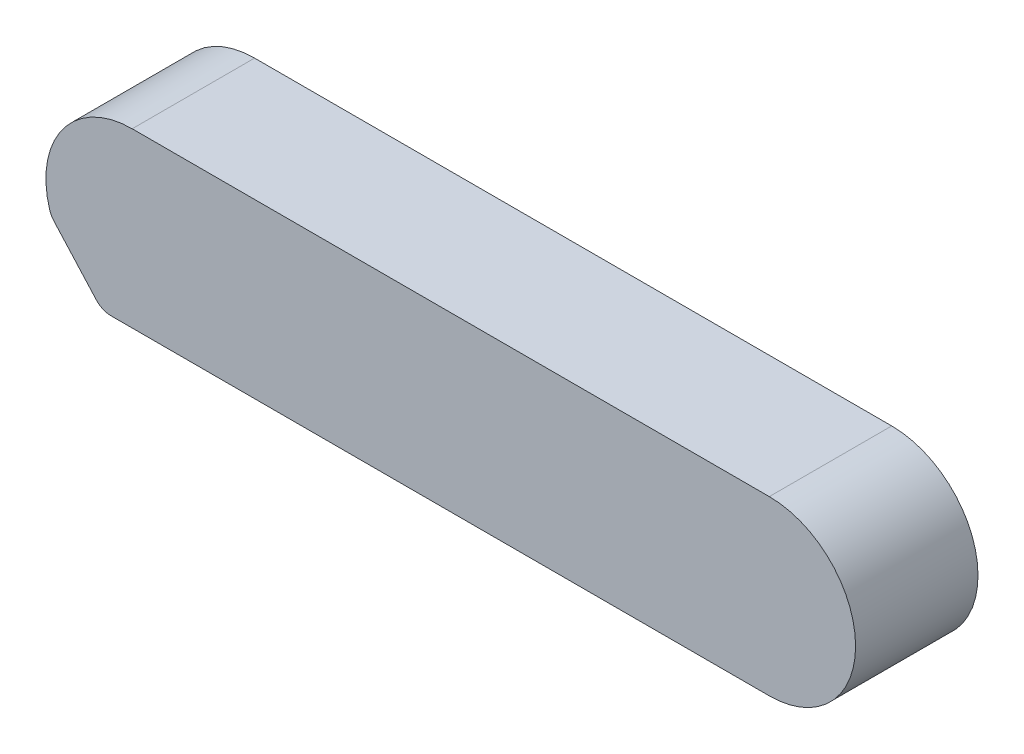
from build123d import *

# Parameters (mm, degrees)
EXTRUSION1_DEPTH      = 60
EXTRUSION1_DEPTH_BACK = 1


with BuildPart() as part:
    # Esquisse1 → Extrusion1 (new, two sides: drawn at the far end of the back side and taken through both)
    with BuildSketch(Plane.XY.offset(-EXTRUSION1_DEPTH_BACK)):
        with BuildLine():
            Line((-356.481440216, -16.365912372), (-335.479161402, -39.691306064))
            ThreePointArc((-335.479161402, -39.691306064), (-332.115079578, -42.135454576), (-328.047713147, -43))
            Line((-328.047713147, -43), (0, -43))
            ThreePointArc((0, -43), (43, 0), (0, 43))
            Line((0, 43), (-317.5, 43))
            ThreePointArc((-317.5, 43), (-352.076517488, 25.562950503), (-358.610595586, -12.60630519))
            ThreePointArc((-358.610595586, -12.60630519), (-357.751492884, -14.602474173), (-356.481440216, -16.365912372))
        make_face()
    extrude(amount=EXTRUSION1_DEPTH + EXTRUSION1_DEPTH_BACK)


solid = part.part
